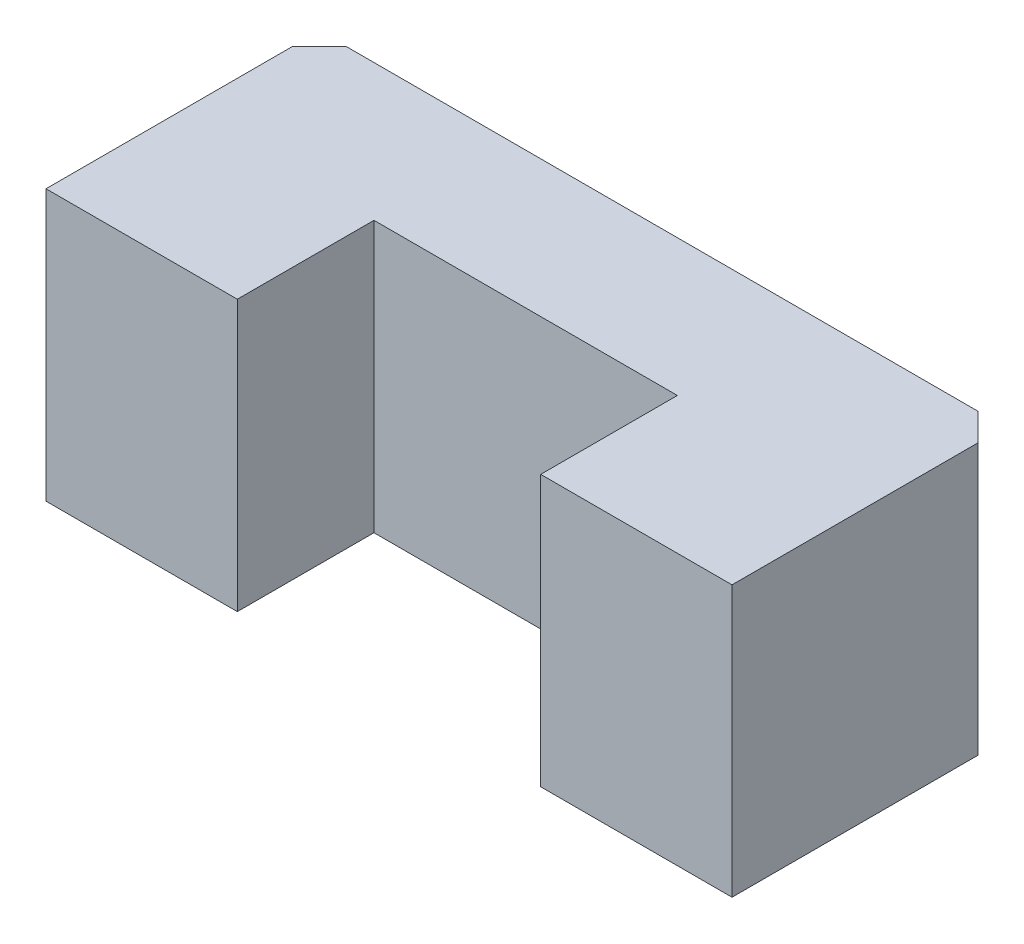
from build123d import *

# Parameters (mm, degrees)
SKETCH_1_W      = 11.1
SKETCH_1_H      = 9.9
EXTRUDE_1_DEPTH = 5
SKETCH_1_3_W    = 7
SKETCH_1_3_H    = 9.9
EXTRUDE_2_DEPTH = 10
CHAMFER_1_SIZE  = 1


with BuildPart() as part:
    # 스케치1 → 보스-돌출1 (new body)
    with BuildSketch(Plane.XY):
        Rectangle(SKETCH_1_W, SKETCH_1_H)
    extrude(amount=EXTRUDE_1_DEPTH)

    # 스케치1<3> → 보스-돌출2 (add)
    with BuildSketch(Plane.XY):
        with Locations((-9.05, 0)):
            Rectangle(SKETCH_1_3_W, SKETCH_1_3_H)
        with Locations((9.05, 0)):
            Rectangle(SKETCH_1_3_W, SKETCH_1_3_H)
    extrude(amount=EXTRUDE_2_DEPTH)

    # 모따기1
    chamfer_1_edges = [part.edges().sort_by_distance(p)[0] for p in [
        (12.55, 0, 0),
        (-12.55, 0, 0),
    ]]
    chamfer(chamfer_1_edges, length=CHAMFER_1_SIZE)


solid = part.part
